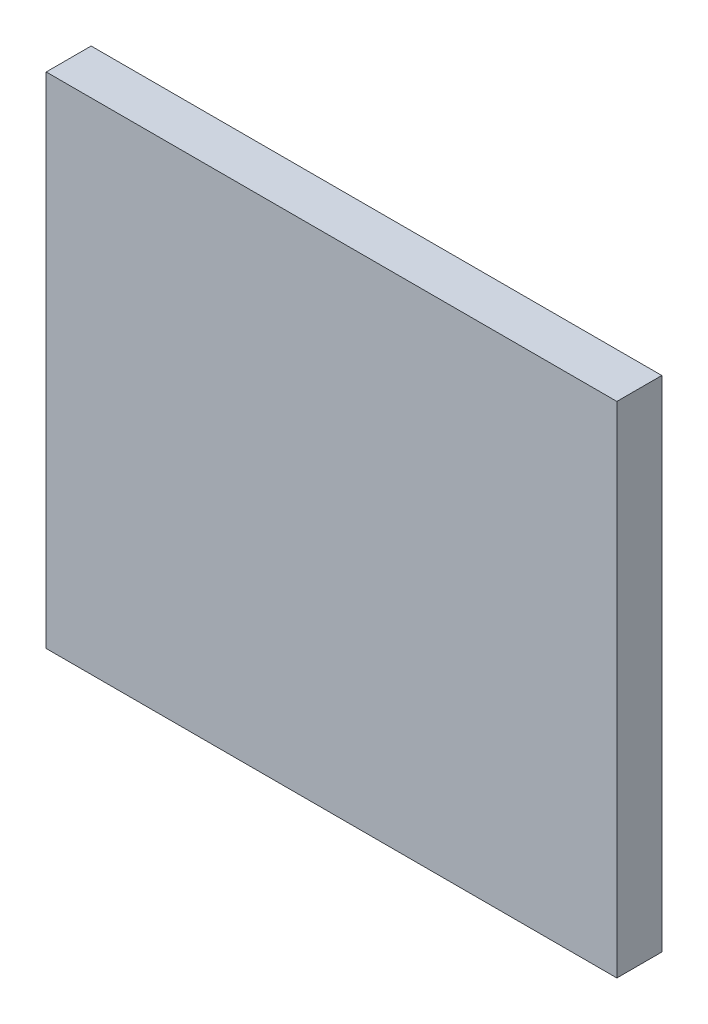
from build123d import *

# Parameters (mm, degrees)
SKETCH1_W           = 20.32
SKETCH1_H           = 17.78
BOSS_EXTRUDE1_DEPTH = 1.6
SKETCH2_W           = 10.541
SKETCH2_H           = 7.366
BOSS_EXTRUDE2_DEPTH = 3.556


with BuildPart() as part:
    # Sketch1 → Boss-Extrude1 (new body)
    with BuildSketch(Plane.XY):
        Rectangle(SKETCH1_W, SKETCH1_H)
    extrude(amount=BOSS_EXTRUDE1_DEPTH)

    # Sketch2 → Boss-Extrude2 (add)
    with BuildSketch(Plane.XY):
        Rectangle(SKETCH2_W, SKETCH2_H)
    extrude(amount=-BOSS_EXTRUDE2_DEPTH)


solid = part.part
